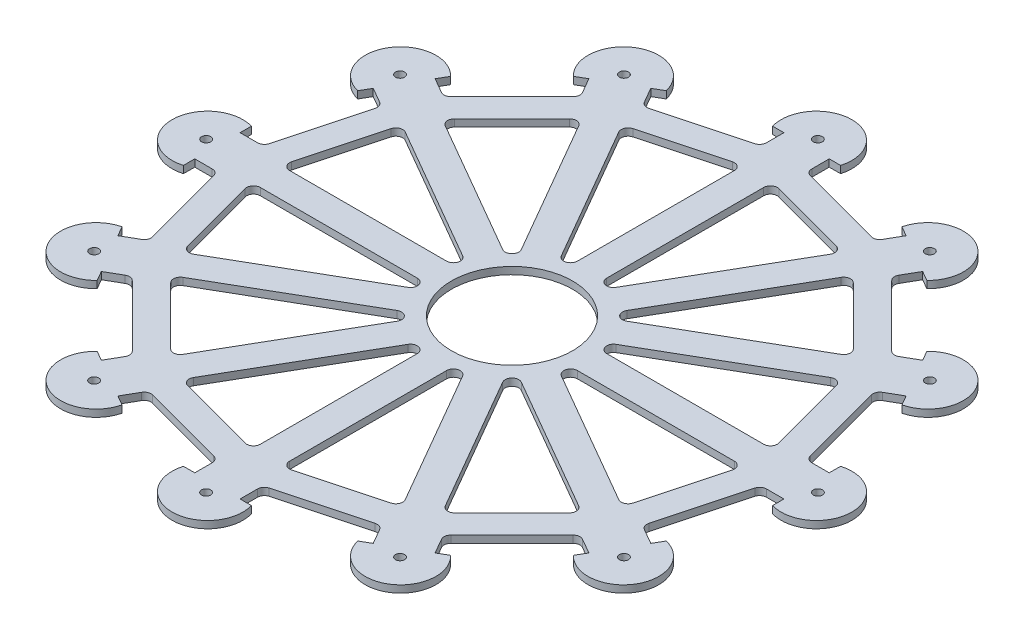
from build123d import *

# Parameters (mm, degrees)
BOSS_EXTRUDE1_DEPTH     = 3.18
FILLET1_R               = 3
CIRPATTERN27_COUNT      = 12
SKETCH3_R               = 3.175
CUT_EXTRUDE1_DEPTH      = 213.155868172
SKETCH4_R               = 1.35
CUT_EXTRUDE2_DEPTH      = 213.155868172
SKETCH5_R               = 2
CUT_EXTRUDE3_DEPTH      = 213.155868172
CIRPATTERN28_COUNT      = 12
CUT_EXTRUDE5_DEPTH      = 213.155868172
CUT_EXTRUDE5_DEPTH_BACK = 213.155868172
SKETCH6_R               = 26.721136004


with BuildPart() as part:
    # Sketch1 → Boss-Extrude1 (new body)
    with BuildSketch(Plane(origin=(0, 0, 0), x_dir=(1, 0, 0), z_dir=(0, 1, 0))):
        with BuildLine():
            Line((0, 0), (0, 150))
            ThreePointArc((0, 150), (12.5, 143.75), (15, 130))
            Line((15, 130), (10, 130))
            Line((10, 130), (10, 120))
            Line((10, 120), (30.669872981, 114.461524227))
            Line((30.669872981, 114.461524227), (27.56404444, 102.870414312))
            Line((27.56404444, 102.870414312), (6.470476128, 108.522418906))
            Line((6.470476128, 108.522418906), (6.470476128, 24.148145657))
            Line((6.470476128, 24.148145657), (0, 0))
        make_face()
    boss_extrude1 = extrude(amount=BOSS_EXTRUDE1_DEPTH)

    # Mirror1: Boss-Extrude1 across plane
    add(boss_extrude1.mirror(Plane(origin=(30.669872981, 3.18, -114.461524227), x_dir=(-0.2588190451025218, 0, 0.965925826289068), z_dir=(-0.9659258262890681, 0, -0.2588190451025218))))

    # Fillet1
    fillet1_edges = [part.edges().sort_by_distance(p)[0] for p in [
        (6.470476128, 1.59, -24.148145657),
        (48.657612752, 1.59, -97.218409717),
        (6.470476128, 1.59, -108.522418906),
        (51.339745962, 1.59, -108.923048454),
        (10, 1.59, -120),
    ]]
    fillet(fillet1_edges, radius=FILLET1_R)


with BuildPart() as cirpattern27_1:
    # CirPattern27: pattern copy
    add(part.part.rotate(Axis((0, 3.18, 0), (0, -1, 0)), 1 * 360 / CIRPATTERN27_COUNT))


with BuildPart() as cirpattern27_2:
    # CirPattern27: pattern copy
    add(part.part.rotate(Axis((0, 3.18, 0), (0, -1, 0)), 2 * 360 / CIRPATTERN27_COUNT))


with BuildPart() as cirpattern27_3:
    # CirPattern27: pattern copy
    add(part.part.rotate(Axis((0, 3.18, 0), (0, -1, 0)), 3 * 360 / CIRPATTERN27_COUNT))


with BuildPart() as cirpattern27_4:
    # CirPattern27: pattern copy
    add(part.part.rotate(Axis((0, 3.18, 0), (0, -1, 0)), 4 * 360 / CIRPATTERN27_COUNT))


with BuildPart() as cirpattern27_5:
    # CirPattern27: pattern copy
    add(part.part.rotate(Axis((0, 3.18, 0), (0, -1, 0)), 5 * 360 / CIRPATTERN27_COUNT))


with BuildPart() as cirpattern27_6:
    # CirPattern27: pattern copy
    add(part.part.rotate(Axis((0, 3.18, 0), (0, -1, 0)), 6 * 360 / CIRPATTERN27_COUNT))


with BuildPart() as cirpattern27_7:
    # CirPattern27: pattern copy
    add(part.part.rotate(Axis((0, 3.18, 0), (0, -1, 0)), 7 * 360 / CIRPATTERN27_COUNT))


with BuildPart() as cirpattern27_8:
    # CirPattern27: pattern copy
    add(part.part.rotate(Axis((0, 3.18, 0), (0, -1, 0)), 8 * 360 / CIRPATTERN27_COUNT))


with BuildPart() as cirpattern27_9:
    # CirPattern27: pattern copy
    add(part.part.rotate(Axis((0, 3.18, 0), (0, -1, 0)), 9 * 360 / CIRPATTERN27_COUNT))


with BuildPart() as cirpattern27_10:
    # CirPattern27: pattern copy
    add(part.part.rotate(Axis((0, 3.18, 0), (0, -1, 0)), 10 * 360 / CIRPATTERN27_COUNT))


with BuildPart() as cirpattern27_11:
    # CirPattern27: pattern copy
    add(part.part.rotate(Axis((0, 3.18, 0), (0, -1, 0)), 11 * 360 / CIRPATTERN27_COUNT))


with BuildPart() as cirpattern27_8_1:
    add(cirpattern27_8.part)

    # Combine1: union CirPattern27_9, CirPattern27_10, CirPattern27_11, part, CirPattern27_1, CirPattern27_2, CirPattern27_3, CirPattern27_4, CirPattern27_5, CirPattern27_6, CirPattern27_7
    add(cirpattern27_9.part)
    add(cirpattern27_10.part)
    add(cirpattern27_11.part)
    add(part.part)
    add(cirpattern27_1.part)
    add(cirpattern27_2.part)
    add(cirpattern27_3.part)
    add(cirpattern27_4.part)
    add(cirpattern27_5.part)
    add(cirpattern27_6.part)
    add(cirpattern27_7.part)

    # Sketch3 → Cut-Extrude1 (cut, through all)
    with BuildSketch(Plane(origin=(0, 3.18, 0), x_dir=(1, 0, 0), z_dir=(0, 1, 0))):
        Circle(SKETCH3_R)
    extrude(amount=-CUT_EXTRUDE1_DEPTH, mode=Mode.SUBTRACT)

    # Sketch4 → Cut-Extrude2 (cut, through all)
    with BuildSketch(Plane(origin=(0, 3.18, 0), x_dir=(1, 0, 0), z_dir=(0, 1, 0))):
        with Locations((0, 9.5)):
            Circle(SKETCH4_R)
        with Locations((8.227241336, 4.75)):
            Circle(SKETCH4_R)
        with Locations((8.227241336, -4.75)):
            Circle(SKETCH4_R)
        with Locations((0, -9.5)):
            Circle(SKETCH4_R)
        with Locations((-8.227241336, -4.75)):
            Circle(SKETCH4_R)
        with Locations((-8.227241336, 4.75)):
            Circle(SKETCH4_R)
    extrude(amount=-CUT_EXTRUDE2_DEPTH, mode=Mode.SUBTRACT)

    # Sketch5 → Cut-Extrude3 (cut, through all)
    with BuildSketch(Plane(origin=(0, 3.18, 0), x_dir=(1, 0, 0), z_dir=(0, 1, 0))):
        with Locations((0, 135)):
            Circle(SKETCH5_R)
    cut_extrude3 = extrude(amount=-CUT_EXTRUDE3_DEPTH, mode=Mode.SUBTRACT)

    # CirPattern28: Cut-Extrude3 ×12 about axis
    cirpattern28_axis = Axis((0, 3.18, 0), (0, -1, 0))
    for i in range(1, CIRPATTERN28_COUNT):
        add(cut_extrude3.rotate(cirpattern28_axis, i * 360 / CIRPATTERN28_COUNT), mode=Mode.SUBTRACT)

    # Sketch6 → Cut-Extrude5 (cut, two sides: drawn at the far end of the back side and taken through both)
    with BuildSketch(Plane(origin=(0, 0, 0), x_dir=(1, 0, 0), z_dir=(0, 1, 0)).offset(-CUT_EXTRUDE5_DEPTH_BACK)):
        Circle(SKETCH6_R)
    extrude(amount=CUT_EXTRUDE5_DEPTH + CUT_EXTRUDE5_DEPTH_BACK, mode=Mode.SUBTRACT)


solid = cirpattern27_8_1.part
